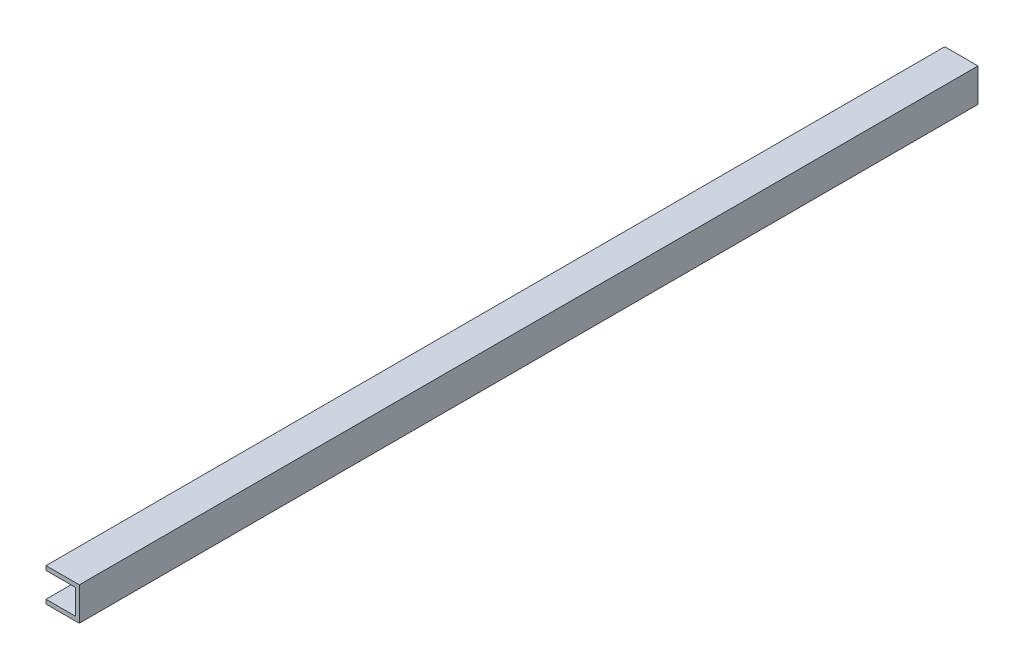
from build123d import *

# Parameters (mm, degrees)
BOSS_EXTRUDE1_DEPTH = 685.8


with BuildPart() as part:
    # Sketch1 → Boss-Extrude1 (new body)
    with BuildSketch(Plane.XY):
        Polygon((-8.352785954, 0.477156812), (-8.352785954, -2.697843188), (13.999214046, -2.697843188), (13.999214046, -21.747843188), (-8.352785954, -21.747843188), (-8.352785954, -24.922843188), (17.047214046, -24.922843188), (17.047214046, 0.477156812), align=None)
    extrude(amount=BOSS_EXTRUDE1_DEPTH)


solid = part.part
